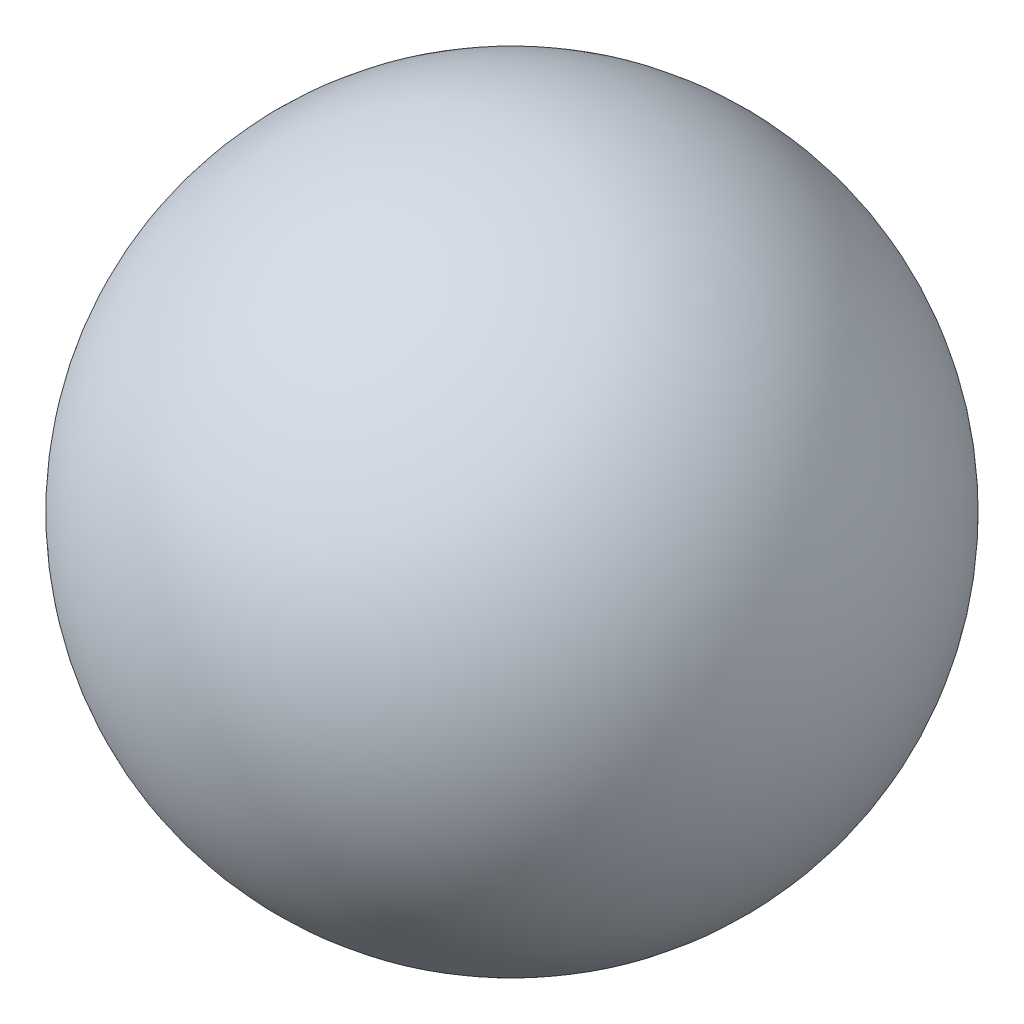
from build123d import *


with BuildPart() as part:
    # 草图1 → 旋转1 (revolve)
    with BuildSketch(Plane.XY):
        with BuildLine():
            Line((0, 0), (0, 17))
            ThreePointArc((0, 17), (-8.5, 8.5), (0, 0))
        make_face()
    revolve(axis=Axis((0, 0, 0), (0, 1, 0)))


solid = part.part
